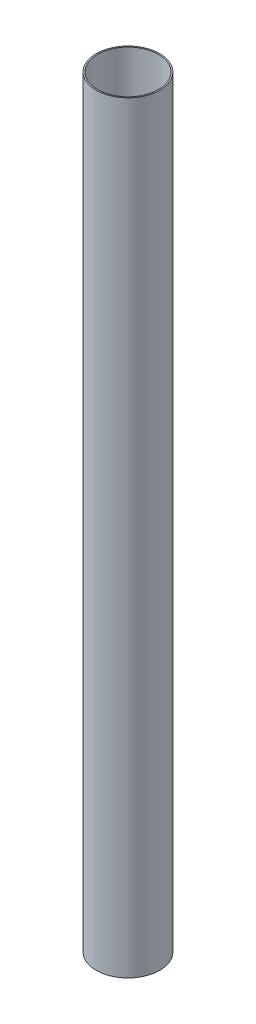
from build123d import *

# Parameters (mm, degrees)
ESQUISSE2_R        = 62.5
ESQUISSE2_R_2      = 60
BOSS_EXTRU_1_DEPTH = 1500


with BuildPart() as part:
    # Esquisse2 → Boss.-Extru.1 (new body)
    with BuildSketch(Plane(origin=(0, 0, 0), x_dir=(1, 0, 0), z_dir=(0, 1, 0))):
        with Locations(Location((-6.548761907, -11.403878492, 0), (0, 0, 270))):
            Circle(ESQUISSE2_R)
        with Locations(Location((-6.548761907, -11.403878492, 0), (0, 0, 270))):
            Circle(ESQUISSE2_R_2, mode=Mode.SUBTRACT)
    extrude(amount=BOSS_EXTRU_1_DEPTH)


solid = part.part
